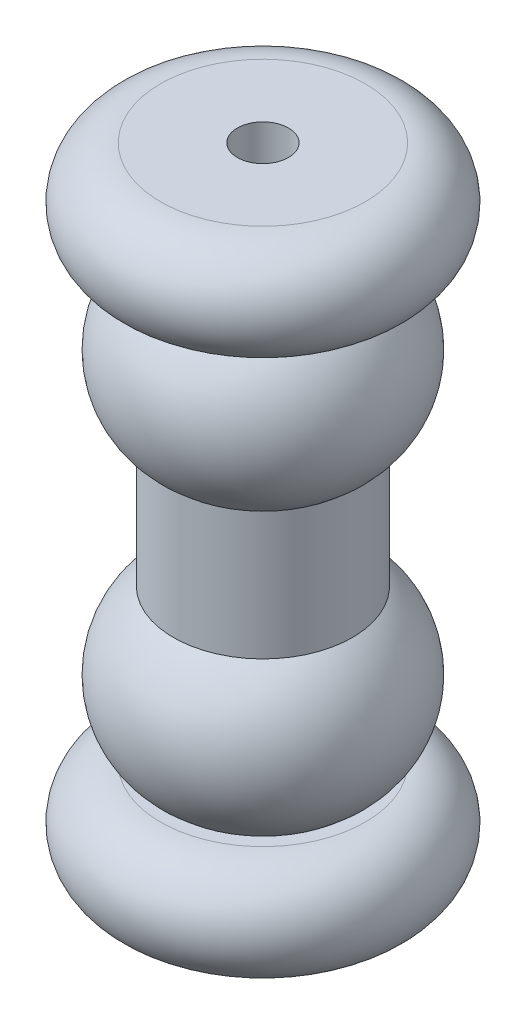
from build123d import *


with BuildPart() as part:
    # Sketch1 → Revolve1 (revolve)
    with BuildSketch(Plane.XY, mode=Mode.PRIVATE) as revolve1_sk:
        with BuildLine():
            Line((4, 25), (1, 25))
            Line((1, 25), (1, 0))
            Line((1, 0), (4, 0))
            ThreePointArc((4, 0), (6, 2), (4, 4))
            Line((4, 4), (3.5, 4))
            ThreePointArc((3.5, 4), (5, 7), (3.5, 10))
            Line((3.5, 10), (3.5, 15))
            ThreePointArc((3.5, 15), (5, 18), (3.5, 21))
            Line((3.5, 21), (4, 21))
            ThreePointArc((4, 21), (6, 23), (4, 25))
        make_face()
    revolve(revolve1_sk.sketch.rotate(Axis((0, 0, 0), (0, 1, 0)), 90), axis=Axis((0, 0, 0), (0, 1, 0)))


solid = part.part
